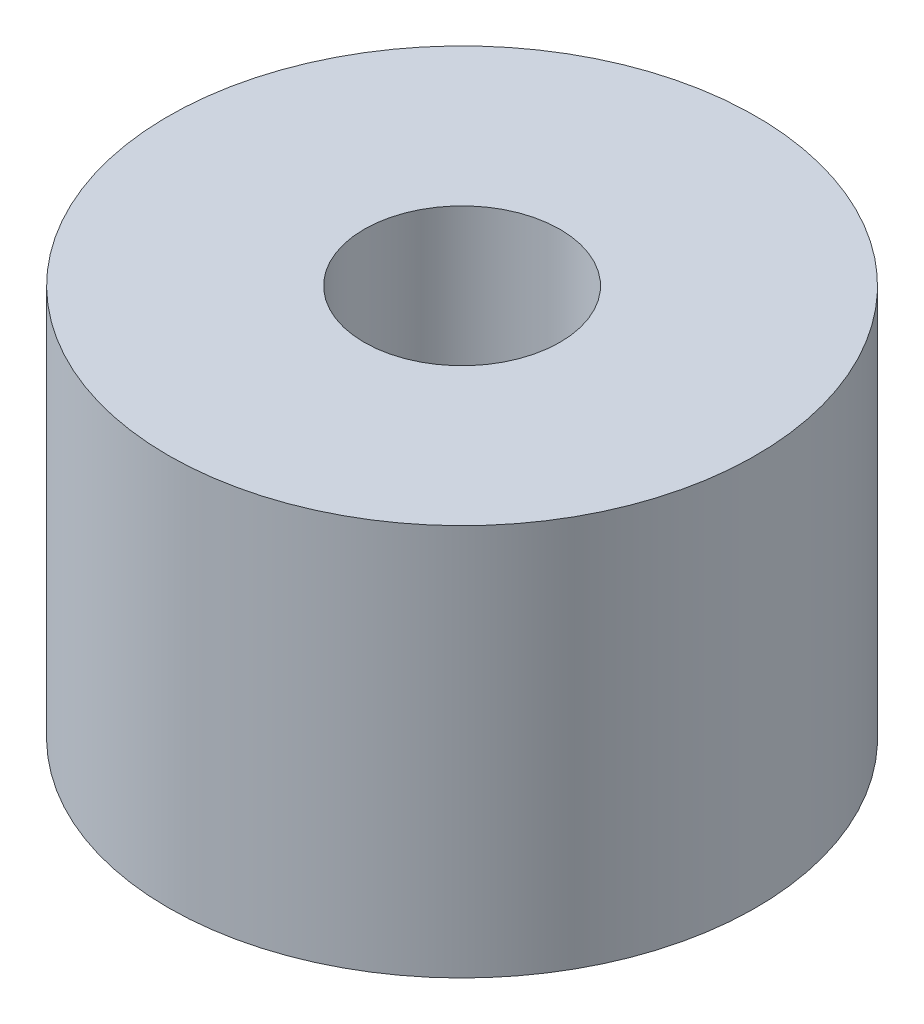
from build123d import *

# Parameters (mm, degrees)
SKETCH1_R           = 3.75
SKETCH1_R_2         = 1.25
BOSS_EXTRUDE1_DEPTH = 5


with BuildPart() as part:
    # Sketch1 → Boss-Extrude1 (new body)
    with BuildSketch(Plane(origin=(0, 0, 0), x_dir=(1, 0, 0), z_dir=(0, 1, 0))):
        with Locations(Location((0, 0, 0), (0, 0, 270))):
            Circle(SKETCH1_R)
        with Locations(Location((0, 0, 0), (0, 0, 270))):
            Circle(SKETCH1_R_2, mode=Mode.SUBTRACT)
    extrude(amount=BOSS_EXTRUDE1_DEPTH)


solid = part.part
